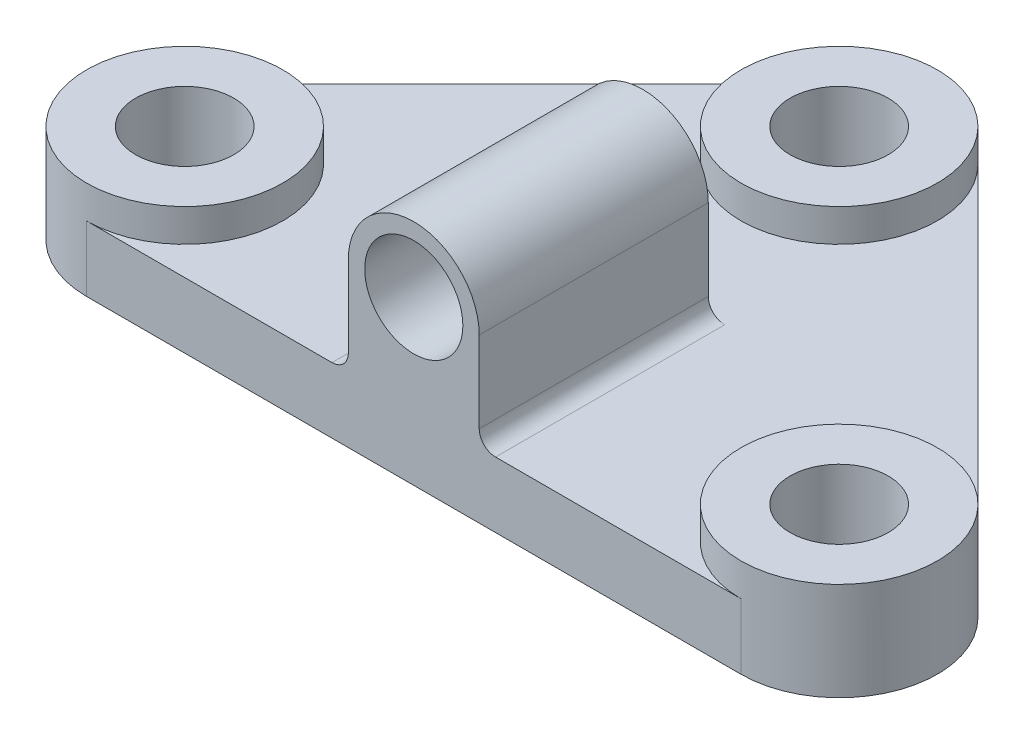
from build123d import *

# Parameters (mm, degrees)
BOSS_EXTRUDE1_DEPTH = 20
SKETCH1_3_R         = 30
SKETCH1_3_R_2       = 15
BOSS_EXTRUDE2_DEPTH = 30
SKETCH1_4_W         = 40
SKETCH1_4_H         = 70
BOSS_EXTRUDE3_DEPTH = 69.8
FILLET1_RADIUS      = 20
FILLET1_LENGTH      = 70
FILLET2_R           = 5
CUT_EXTRUDE1_REACH  = 290.742
SKETCH2_R           = 15


with BuildPart() as part:
    # Sketch1 → Boss-Extrude1 (new body)
    with BuildSketch(Plane(origin=(0, 0, 0), x_dir=(1, 0, 0), z_dir=(0, 1, 0))):
        with BuildLine():
            Line((78.786796564, 121.213203436), (-21.213203436, 21.213203436))
            ThreePointArc((-21.213203436, 21.213203436), (11.480502971, 27.716385975), (30, 0))
            ThreePointArc((30, 0), (21.213203436, -21.213203436), (0, -30))
            Line((0, -30), (80, -30))
            Line((80, -30), (80, 40))
            Line((80, 40), (120, 40))
            Line((120, 40), (120, -30))
            Line((120, -30), (200, -30))
            ThreePointArc((200, -30), (172.283614025, 11.480502971), (221.213203436, 21.213203436))
            Line((221.213203436, 21.213203436), (121.213203436, 121.213203436))
            ThreePointArc((121.213203436, 121.213203436), (127.716385975, 111.480502971), (130, 100))
            ThreePointArc((130, 100), (88.519497029, 72.283614025), (78.786796564, 121.213203436))
        make_face()
    extrude(amount=BOSS_EXTRUDE1_DEPTH)

    # Sketch1<3> → Boss-Extrude2 (add)
    # profile 1 of 3: a face of its own
    with BuildSketch(Plane(origin=(0, 0, 0), x_dir=(1, 0, 0), z_dir=(0, 1, 0))):
        with Locations(Location((0, 0, 0), (0, 0, 270))):
            Circle(SKETCH1_3_R)
        with Locations(Location((0, 0, 0), (0, 0, 270))):
            Circle(SKETCH1_3_R_2, mode=Mode.SUBTRACT)
    # profile 2 of 3: a face of its own
    with BuildSketch(Plane(origin=(0, 0, 0), x_dir=(1, 0, 0), z_dir=(0, 1, 0))):
        with Locations(Location((100, 100, 0), (0, 0, 45))):
            Circle(SKETCH1_3_R)
        with Locations(Location((100, 100, 0), (0, 0, 270))):
            Circle(SKETCH1_3_R_2, mode=Mode.SUBTRACT)
    # profile 3 of 3: a face of its own
    with BuildSketch(Plane(origin=(0, 0, 0), x_dir=(1, 0, 0), z_dir=(0, 1, 0))):
        with Locations(Location((200, 0, 0), (0, 0, 270))):
            Circle(SKETCH1_3_R)
        with Locations(Location((200, 0, 0), (0, 0, 270))):
            Circle(SKETCH1_3_R_2, mode=Mode.SUBTRACT)
    extrude(amount=BOSS_EXTRUDE2_DEPTH)

    # Sketch1<4> → Boss-Extrude3 (add)
    with BuildSketch(Plane(origin=(0, 0, 0), x_dir=(1, 0, 0), z_dir=(0, 1, 0))):
        with Locations((100, 5)):
            Rectangle(SKETCH1_4_W, SKETCH1_4_H)
    extrude(amount=BOSS_EXTRUDE3_DEPTH)

    # Fillet1: full round fillet: the end face becomes a half cylinder, R = half its width
    fillet1_face = Plane((100, 69.8, -5), x_dir=(0, 0, 1), z_dir=(0, 1, 0))  # on the end face: x along it, z out of the body
    fillet1_slab = fillet1_face.offset(-FILLET1_RADIUS / 2) * Box(FILLET1_LENGTH, 2 * FILLET1_RADIUS, FILLET1_RADIUS, mode=Mode.PRIVATE)  # the body's end, R deep
    fillet1_round = Plane((100, 49.8, -5), x_dir=(0, 1, 0), z_dir=(0, 0, 1)) * Cylinder(FILLET1_RADIUS, FILLET1_LENGTH, mode=Mode.PRIVATE)  # its axis R under the face
    add(fillet1_slab - fillet1_round, mode=Mode.SUBTRACT)

    # Fillet2
    fillet2_edges = [part.edges().sort_by_distance(p)[0] for p in [
        (80, 20, -5),
        (120, 20, -5),
    ]]
    fillet(fillet2_edges, radius=FILLET2_R)

    # Sketch2 → Cut-Extrude1 (cut, up to next)
    with BuildSketch(Plane.XY.offset(30), mode=Mode.PRIVATE) as cut_extrude1_sk1:
        with Locations((100, 49.8)):
            Circle(SKETCH2_R)
    cut_extrude1_tool1 = extrude(cut_extrude1_sk1.sketch, amount=-CUT_EXTRUDE1_REACH, mode=Mode.PRIVATE) & part.part
    add(cut_extrude1_tool1.solids().sort_by_distance((100, 49.8, 30))[0], mode=Mode.SUBTRACT)


solid = part.part
